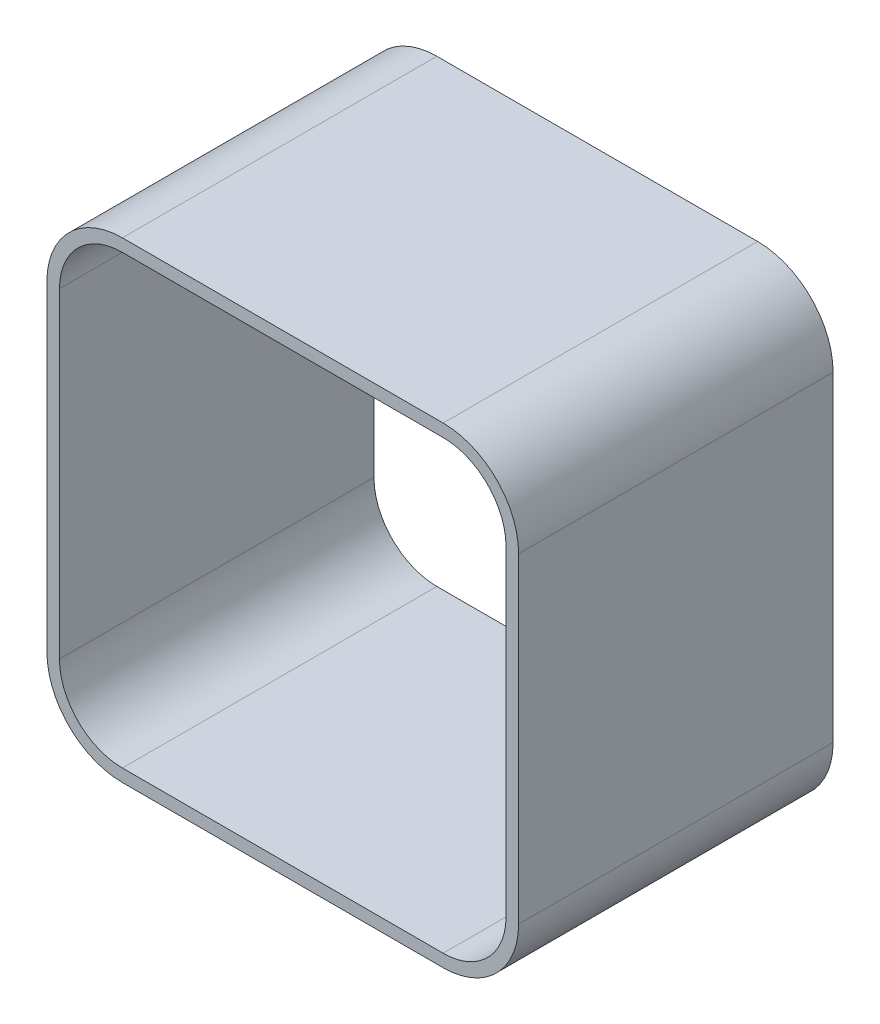
from build123d import *

# Parameters (mm, degrees)
SKETCH1_W           = 15
SKETCH1_H           = 15
SKETCH1_W_2         = 14.2
SKETCH1_H_2         = 14.2
BOSS_EXTRUDE1_DEPTH = 10
FILLET1_R           = 2
FILLET2_R           = 2.4


with BuildPart() as part:
    # Sketch1 → Boss-Extrude1 (new body)
    with BuildSketch(Plane.XY):
        Rectangle(SKETCH1_W, SKETCH1_H)
        Rectangle(SKETCH1_W_2, SKETCH1_H_2, mode=Mode.SUBTRACT)
    extrude(amount=BOSS_EXTRUDE1_DEPTH)

    # Fillet1
    fillet1_edges = [part.edges().sort_by_distance(p)[0] for p in [
        (7.1, -7.1, 5),
        (7.1, 7.1, 5),
        (-7.1, 7.1, 5),
        (-7.1, -7.1, 5),
    ]]
    fillet(fillet1_edges, radius=FILLET1_R)

    # Fillet2
    fillet2_edges = [part.edges().sort_by_distance(p)[0] for p in [
        (7.5, -7.5, 5),
        (-7.5, -7.5, 5),
        (-7.5, 7.5, 5),
        (7.5, 7.5, 5),
    ]]
    fillet(fillet2_edges, radius=FILLET2_R)


solid = part.part
